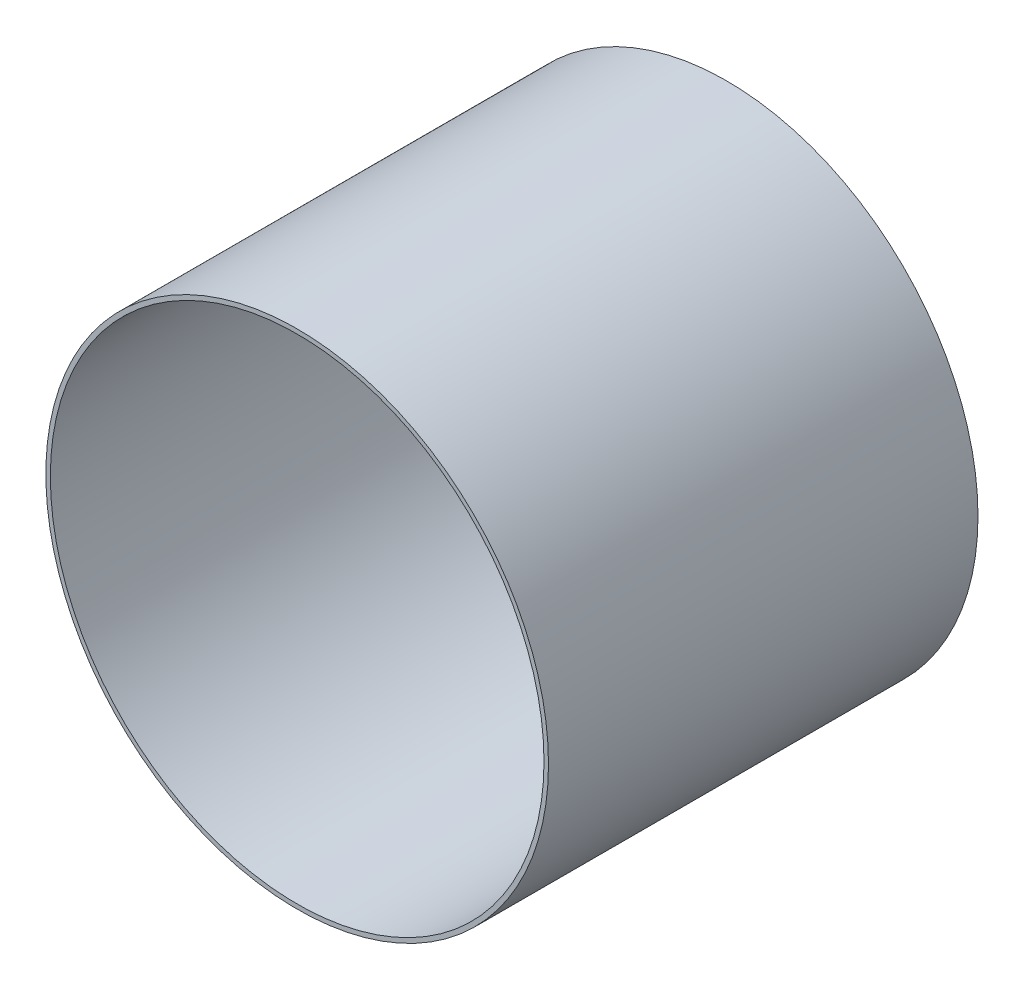
from build123d import *

# Parameters (mm, degrees)
SKETCH1_R      = 71.12
SKETCH1_R_2    = 69.85
EXTRUDE1_DEPTH = 121.539


with BuildPart() as part:
    # Sketch1 → Extrude1 (new body)
    with BuildSketch(Plane.XY):
        Circle(SKETCH1_R)
        Circle(SKETCH1_R_2, mode=Mode.SUBTRACT)
    extrude(amount=EXTRUDE1_DEPTH)


solid = part.part
